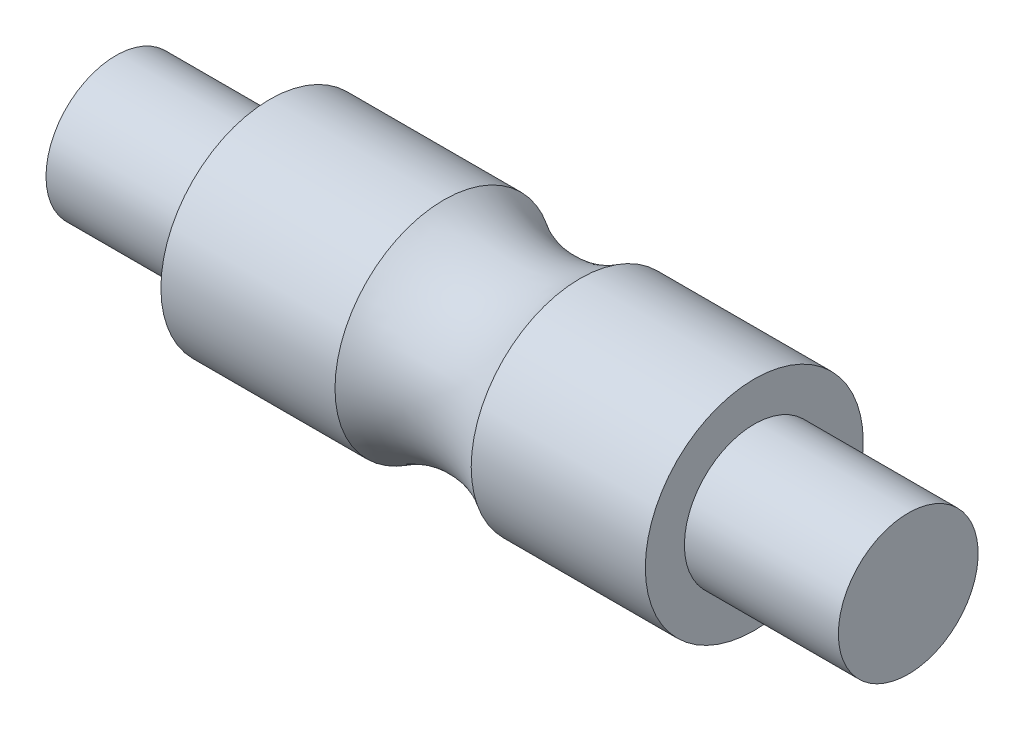
from build123d import *
from build123d.topology import SkipClean


with BuildPart() as part:
    # Sketch1 → Revolve1 (revolve)
    with BuildSketch(Plane.XY):
        with BuildLine():
            Line((0, 0), (8.4963, 0))
            Line((8.4963, 0), (8.4963, 1.4986))
            Line((8.4963, 1.4986), (5.1943, 1.4986))
            Line((5.1943, 1.4986), (5.1943, 2.3368))
            Line((5.1943, 2.3368), (1.4605, 2.3368))
            ThreePointArc((1.4605, 2.3368), (0.761497126, 2.015211192), (0, 1.905))
            Line((0, 1.905), (0, 0))
        make_face()
    revolve1 = revolve(axis=Axis((-9.905629385, 0, 0), (1, 0, 0)))

    # Mirror1: Revolve1 across plane
    with SkipClean():  # the faces are left unmerged after this step: merging them gives an invalid solid
        add(revolve1.mirror(Plane(origin=(0, 0, 0), x_dir=(0, 0, 1), z_dir=(1, 0, 0))))


solid = part.part
